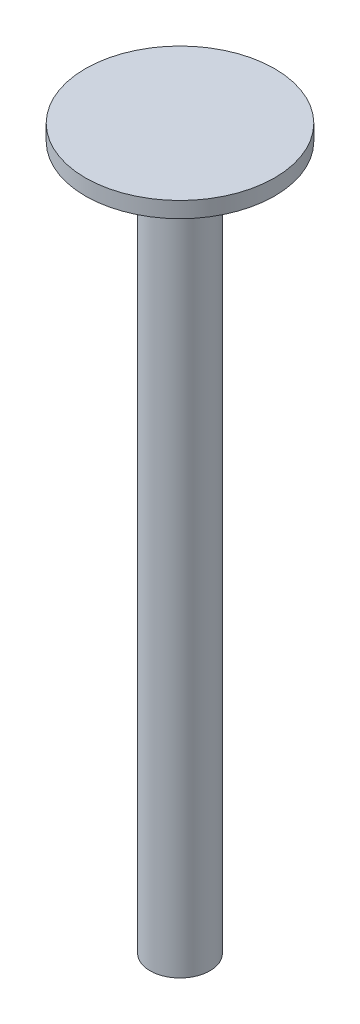
from build123d import *

# Parameters (mm, degrees)
SKETCH_1_R      = 0.95
EXTRUDE_1_DEPTH = 22.3
SKETCH_3_R      = 3
EXTRUDE_2_DEPTH = 0.5


with BuildPart() as part:
    # Эскиз1 → Бобышка-Вытянуть1 (new body)
    with BuildSketch(Plane(origin=(0, 0, 0), x_dir=(1, 0, 0), z_dir=(0, 1, 0))):
        with Locations(Location((0, 0, 0), (0, 0, 270))):
            Circle(SKETCH_1_R)
    extrude(amount=EXTRUDE_1_DEPTH)

    # Эскиз3 → Бобышка-Вытянуть2 (add)
    with BuildSketch(Plane(origin=(0, 22.3, 0), x_dir=(1, 0, 0), z_dir=(0, 1, 0))):
        with Locations(Location((0, 0, 0), (0, 0, 270))):
            Circle(SKETCH_3_R)
    extrude(amount=EXTRUDE_2_DEPTH)


solid = part.part
